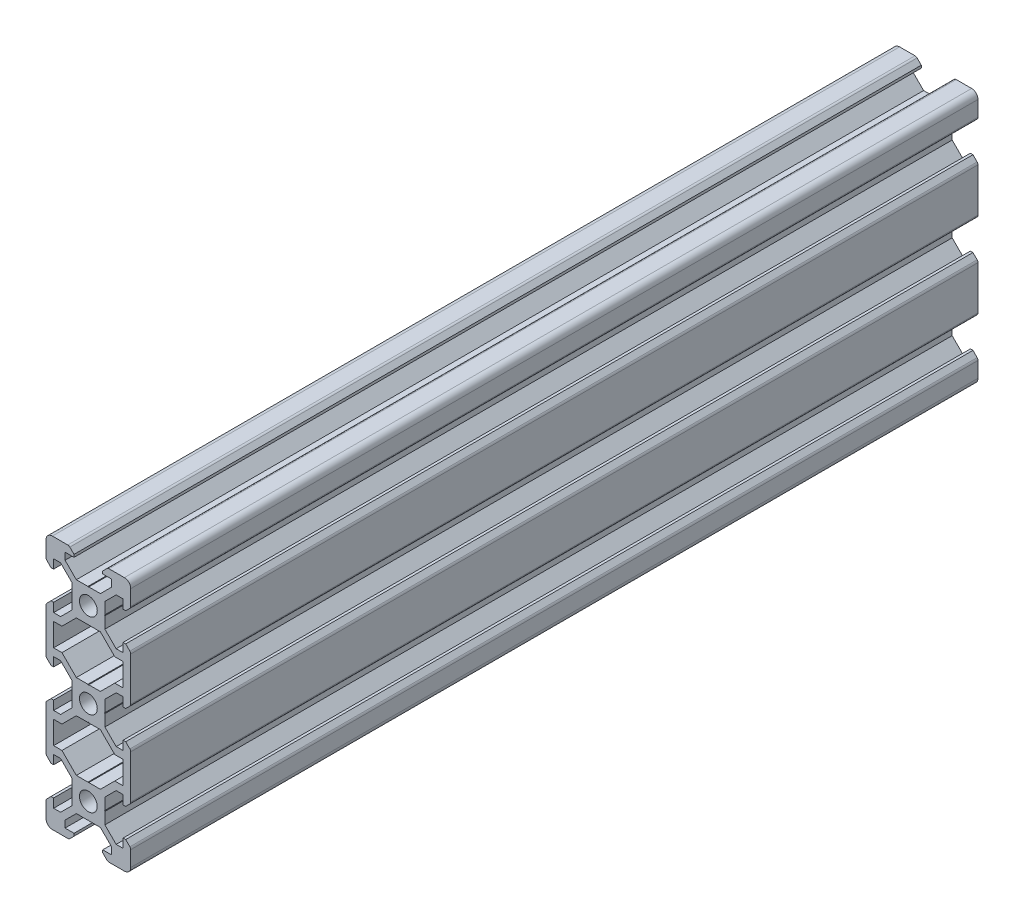
from build123d import *

# Parameters (mm, degrees)
SKETCH1_R           = 2.1
BOSS_EXTRUDE2_DEPTH = 200


with BuildPart() as part:
    # Sketch1 → Boss-Extrude2 (new body)
    with BuildSketch(Plane.XY):
        with BuildLine():
            Line((-8.5, 10), (-4.862792737, 10))
            ThreePointArc((-4.862792737, 10), (-4.598292737, 9.947387679), (-4.374060464, 9.797560464))
            Line((-4.374060464, 9.797560464), (-3.3865, 8.81))
            Line((-3.3865, 8.81), (-3.3865, 8.2))
            Line((-3.3865, 8.2), (-5.5, 8.2))
            Line((-5.5, 8.2), (-5.5, 6.561))
            Line((-5.5, 6.561), (-2.8395, 3.9005))
            Line((-2.8395, 3.9005), (-0.1, 3.9005))
            Line((-0.1, 3.9005), (0, 3.8005))
            Line((0, 3.8005), (0.1, 3.9005))
            Line((0.1, 3.9005), (2.8395, 3.9005))
            Line((2.8395, 3.9005), (5.5, 6.561))
            Line((5.5, 6.561), (5.5, 8.2))
            Line((5.5, 8.2), (3.3865, 8.2))
            Line((3.3865, 8.2), (3.3865, 8.81))
            Line((3.3865, 8.81), (4.374060464, 9.797560464))
            ThreePointArc((4.374060464, 9.797560464), (4.598292737, 9.947387679), (4.862792737, 10))
            Line((4.862792737, 10), (8.5, 10))
            ThreePointArc((8.5, 10), (9.560660172, 9.560660172), (10, 8.5))
            Line((10, 8.5), (10, 4.862792737))
            ThreePointArc((10, 4.862792737), (9.947387679, 4.598292737), (9.797560464, 4.374060464))
            Line((9.797560464, 4.374060464), (8.81, 3.3865))
            Line((8.81, 3.3865), (8.2, 3.3865))
            Line((8.2, 3.3865), (8.2, 5.5))
            Line((8.2, 5.5), (6.561, 5.5))
            Line((6.561, 5.5), (3.9005, 2.8395))
            Line((3.9005, 2.8395), (3.9005, 0.1))
            Line((3.9005, 0.1), (3.8005, 0))
            Line((3.8005, 0), (3.9005, -0.1))
            Line((3.9005, -0.1), (3.9005, -2.8395))
            Line((3.9005, -2.8395), (6.561, -5.5))
            Line((6.561, -5.5), (8.2, -5.5))
            Line((8.2, -5.5), (8.2, -3.3865))
            Line((8.2, -3.3865), (8.81, -3.3865))
            Line((8.81, -3.3865), (9.797560464, -4.374060464))
            ThreePointArc((9.797560464, -4.374060464), (9.947387679, -4.598292737), (10, -4.862792737))
            Line((10, -4.862792737), (10, -15.137207263))
            ThreePointArc((10, -15.137207263), (9.947387679, -15.401707263), (9.797560464, -15.625939536))
            Line((9.797560464, -15.625939536), (8.81, -16.6135))
            Line((8.81, -16.6135), (8.2, -16.6135))
            Line((8.2, -16.6135), (8.2, -14.5))
            Line((8.2, -14.5), (6.561, -14.5))
            Line((6.561, -14.5), (3.9005, -17.1605))
            Line((3.9005, -17.1605), (3.9005, -19.9))
            Line((3.9005, -19.9), (3.8005, -20))
            Line((3.8005, -20), (3.9005, -20.1))
            Line((3.9005, -20.1), (3.9005, -22.8395))
            Line((3.9005, -22.8395), (6.561, -25.5))
            Line((6.561, -25.5), (8.2, -25.5))
            Line((8.2, -25.5), (8.2, -23.3865))
            Line((8.2, -23.3865), (8.81, -23.3865))
            Line((8.81, -23.3865), (9.797560464, -24.374060464))
            ThreePointArc((9.797560464, -24.374060464), (9.947387679, -24.598292737), (10, -24.862792737))
            Line((10, -24.862792737), (10, -35.137207263))
            ThreePointArc((10, -35.137207263), (9.947387679, -35.401707263), (9.797560464, -35.625939536))
            Line((9.797560464, -35.625939536), (8.81, -36.6135))
            Line((8.81, -36.6135), (8.2, -36.6135))
            Line((8.2, -36.6135), (8.2, -34.5))
            Line((8.2, -34.5), (6.561, -34.5))
            Line((6.561, -34.5), (3.9005, -37.1605))
            Line((3.9005, -37.1605), (3.9005, -39.9))
            Line((3.9005, -39.9), (3.8005, -40))
            Line((3.8005, -40), (3.9005, -40.1))
            Line((3.9005, -40.1), (3.9005, -42.8395))
            Line((3.9005, -42.8395), (6.561, -45.5))
            Line((6.561, -45.5), (8.2, -45.5))
            Line((8.2, -45.5), (8.2, -43.3865))
            Line((8.2, -43.3865), (8.81, -43.3865))
            Line((8.81, -43.3865), (9.797560464, -44.374060464))
            ThreePointArc((9.797560464, -44.374060464), (9.947387679, -44.598292737), (10, -44.862792737))
            Line((10, -44.862792737), (10, -48.5))
            ThreePointArc((10, -48.5), (9.560660172, -49.560660172), (8.5, -50))
            Line((8.5, -50), (4.862792737, -50))
            ThreePointArc((4.862792737, -50), (4.598292737, -49.947387679), (4.374060464, -49.797560464))
            Line((4.374060464, -49.797560464), (3.3865, -48.81))
            Line((3.3865, -48.81), (3.3865, -48.2))
            Line((3.3865, -48.2), (5.5, -48.2))
            Line((5.5, -48.2), (5.5, -46.561))
            Line((5.5, -46.561), (2.8395, -43.9005))
            Line((2.8395, -43.9005), (0.1, -43.9005))
            Line((0.1, -43.9005), (0, -43.8005))
            Line((0, -43.8005), (-0.1, -43.9005))
            Line((-0.1, -43.9005), (-2.8395, -43.9005))
            Line((-2.8395, -43.9005), (-5.5, -46.561))
            Line((-5.5, -46.561), (-5.5, -48.2))
            Line((-5.5, -48.2), (-3.3865, -48.2))
            Line((-3.3865, -48.2), (-3.3865, -48.81))
            Line((-3.3865, -48.81), (-4.374060464, -49.797560464))
            ThreePointArc((-4.374060464, -49.797560464), (-4.598292737, -49.947387679), (-4.862792737, -50))
            Line((-4.862792737, -50), (-8.5, -50))
            ThreePointArc((-8.5, -50), (-9.560660172, -49.560660172), (-10, -48.5))
            Line((-10, -48.5), (-10, -44.862792737))
            ThreePointArc((-10, -44.862792737), (-9.947387679, -44.598292737), (-9.797560464, -44.374060464))
            Line((-9.797560464, -44.374060464), (-8.81, -43.3865))
            Line((-8.81, -43.3865), (-8.2, -43.3865))
            Line((-8.2, -43.3865), (-8.2, -45.5))
            Line((-8.2, -45.5), (-6.561, -45.5))
            Line((-6.561, -45.5), (-3.9005, -42.8395))
            Line((-3.9005, -42.8395), (-3.9005, -40.1))
            Line((-3.9005, -40.1), (-3.8005, -40))
            Line((-3.8005, -40), (-3.9005, -39.9))
            Line((-3.9005, -39.9), (-3.9005, -37.1605))
            Line((-3.9005, -37.1605), (-6.561, -34.5))
            Line((-6.561, -34.5), (-8.2, -34.5))
            Line((-8.2, -34.5), (-8.2, -36.6135))
            Line((-8.2, -36.6135), (-8.81, -36.6135))
            Line((-8.81, -36.6135), (-9.797560464, -35.625939536))
            ThreePointArc((-9.797560464, -35.625939536), (-9.947387679, -35.401707263), (-10, -35.137207263))
            Line((-10, -35.137207263), (-10, -24.862792737))
            ThreePointArc((-10, -24.862792737), (-9.947387679, -24.598292737), (-9.797560464, -24.374060464))
            Line((-9.797560464, -24.374060464), (-8.81, -23.3865))
            Line((-8.81, -23.3865), (-8.2, -23.3865))
            Line((-8.2, -23.3865), (-8.2, -25.5))
            Line((-8.2, -25.5), (-6.561, -25.5))
            Line((-6.561, -25.5), (-3.9005, -22.8395))
            Line((-3.9005, -22.8395), (-3.9005, -20.1))
            Line((-3.9005, -20.1), (-3.8005, -20))
            Line((-3.8005, -20), (-3.9005, -19.9))
            Line((-3.9005, -19.9), (-3.9005, -17.1605))
            Line((-3.9005, -17.1605), (-6.561, -14.5))
            Line((-6.561, -14.5), (-8.2, -14.5))
            Line((-8.2, -14.5), (-8.2, -16.6135))
            Line((-8.2, -16.6135), (-8.81, -16.6135))
            Line((-8.81, -16.6135), (-9.797560464, -15.625939536))
            ThreePointArc((-9.797560464, -15.625939536), (-9.947387679, -15.401707263), (-10, -15.137207263))
            Line((-10, -15.137207263), (-10, -4.862792737))
            ThreePointArc((-10, -4.862792737), (-9.947387679, -4.598292737), (-9.797560464, -4.374060464))
            Line((-9.797560464, -4.374060464), (-8.81, -3.3865))
            Line((-8.81, -3.3865), (-8.2, -3.3865))
            Line((-8.2, -3.3865), (-8.2, -5.5))
            Line((-8.2, -5.5), (-6.561, -5.5))
            Line((-6.561, -5.5), (-3.9005, -2.8395))
            Line((-3.9005, -2.8395), (-3.9005, -0.1))
            Line((-3.9005, -0.1), (-3.8005, 0))
            Line((-3.8005, 0), (-3.9005, 0.1))
            Line((-3.9005, 0.1), (-3.9005, 2.8395))
            Line((-3.9005, 2.8395), (-6.561, 5.5))
            Line((-6.561, 5.5), (-8.2, 5.5))
            Line((-8.2, 5.5), (-8.2, 3.3865))
            Line((-8.2, 3.3865), (-8.81, 3.3865))
            Line((-8.81, 3.3865), (-9.797560464, 4.374060464))
            ThreePointArc((-9.797560464, 4.374060464), (-9.947387679, 4.598292737), (-10, 4.862792737))
            Line((-10, 4.862792737), (-10, 8.5))
            ThreePointArc((-10, 8.5), (-9.560660172, 9.560660172), (-8.5, 10))
        make_face()
        Circle(SKETCH1_R, mode=Mode.SUBTRACT)
        with Locations((0, -20)):
            Circle(SKETCH1_R, mode=Mode.SUBTRACT)
        with Locations(Location((0, -40, 0), (0, 0, 180))):
            Circle(SKETCH1_R, mode=Mode.SUBTRACT)
        Polygon((-8.2, -12.7), (-8.2, -7.3), (-6.239, -7.3), (-5.5, -6.561), (-2.8395, -3.9005), (-0.1, -3.9005), (0, -3.8005), (0.1, -3.9005), (2.8395, -3.9005), (5.5, -6.561), (6.239, -7.3), (8.2, -7.3), (8.2, -12.7), (6.239, -12.7), (5.5, -13.439), (2.8395, -16.0995), (0.1, -16.0995), (0, -16.1995), (-0.1, -16.0995), (-2.8395, -16.0995), (-5.5, -13.439), (-6.239, -12.7), align=None, mode=Mode.SUBTRACT)
        Polygon((2.8395, -23.9005), (5.5, -26.561), (6.239, -27.3), (8.2, -27.3), (8.2, -32.7), (6.239, -32.7), (5.5, -33.439), (2.8395, -36.0995), (0.1, -36.0995), (0, -36.1995), (-0.1, -36.0995), (-2.8395, -36.0995), (-5.5, -33.439), (-6.239, -32.7), (-8.2, -32.7), (-8.2, -27.3), (-6.239, -27.3), (-5.5, -26.561), (-2.8395, -23.9005), (-0.1, -23.9005), (0, -23.8005), (0.1, -23.9005), align=None, mode=Mode.SUBTRACT)
    extrude(amount=BOSS_EXTRUDE2_DEPTH)


solid = part.part
